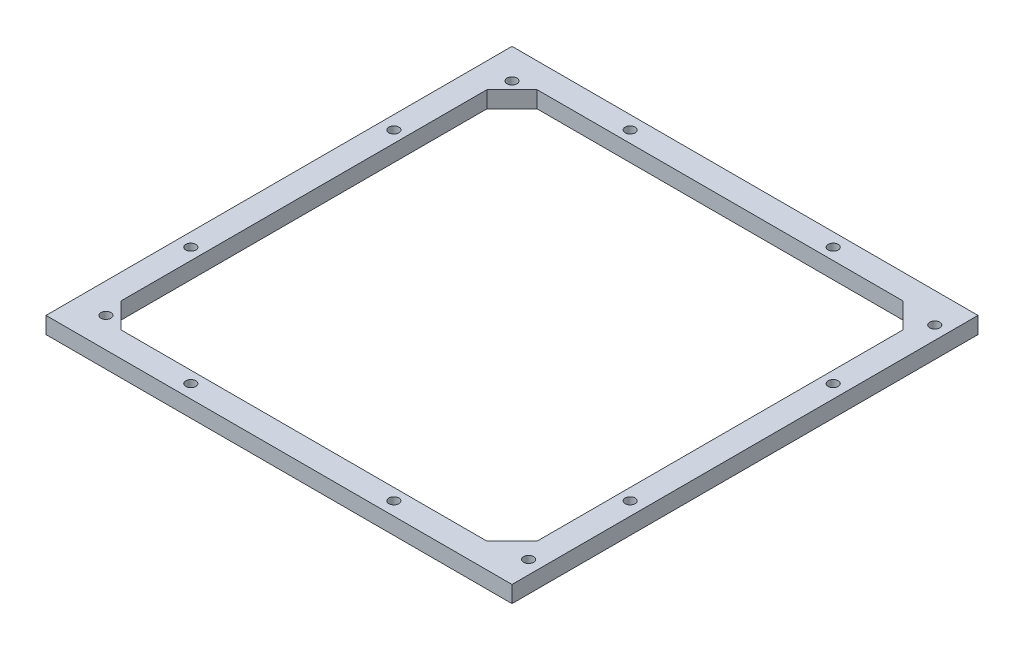
from build123d import *

# Parameters (mm, degrees)
CROQUIS1_W              = 140
CROQUIS1_H              = 140
CROQUIS1_R              = 1.5
SALIENTE_EXTRUIR1_DEPTH = 5


with BuildPart() as part:
    # Croquis1 → Saliente-Extruir1 (new body)
    with BuildSketch(Plane(origin=(0, 0, 0), x_dir=(1, 0, 0), z_dir=(0, 1, 0))):
        Rectangle(CROQUIS1_W, CROQUIS1_H)
        with Locations(Location((-61, 61, 0), (0, 0, 270))):
            Circle(CROQUIS1_R, mode=Mode.SUBTRACT)
        with Locations(Location((66, 61, 0), (0, 0, 270))):
            Circle(CROQUIS1_R, mode=Mode.SUBTRACT)
        with Locations(Location((66, -61, 0), (0, 0, 270))):
            Circle(CROQUIS1_R, mode=Mode.SUBTRACT)
        with Locations(Location((-61, -61, 0), (0, 0, 270))):
            Circle(CROQUIS1_R, mode=Mode.SUBTRACT)
        with Locations(Location((66, 30.5, 0), (0, 0, 270))):
            Circle(CROQUIS1_R, mode=Mode.SUBTRACT)
        with Locations(Location((66, -30.5, 0), (0, 0, 270))):
            Circle(CROQUIS1_R, mode=Mode.SUBTRACT)
        with Locations(Location((-30.5, -66, 0), (0, 0, 270))):
            Circle(CROQUIS1_R, mode=Mode.SUBTRACT)
        with Locations(Location((30.5, -66, 0), (0, 0, 270))):
            Circle(CROQUIS1_R, mode=Mode.SUBTRACT)
        with Locations(Location((-30.5, 66, 0), (0, 0, 90))):
            Circle(CROQUIS1_R, mode=Mode.SUBTRACT)
        with Locations(Location((30.5, 66, 0), (0, 0, 90))):
            Circle(CROQUIS1_R, mode=Mode.SUBTRACT)
        with Locations(Location((-66, 30.5, 0), (0, 0, 90))):
            Circle(CROQUIS1_R, mode=Mode.SUBTRACT)
        with Locations(Location((-66, -30.5, 0), (0, 0, 90))):
            Circle(CROQUIS1_R, mode=Mode.SUBTRACT)
        Polygon((-55, -62.5), (-62.5, -55), (-62.5, 55), (-55, 62.5), (55, 62.5), (62.5, 55), (62.5, -55), (55, -62.5), align=None, mode=Mode.SUBTRACT)
    extrude(amount=SALIENTE_EXTRUIR1_DEPTH)


solid = part.part
